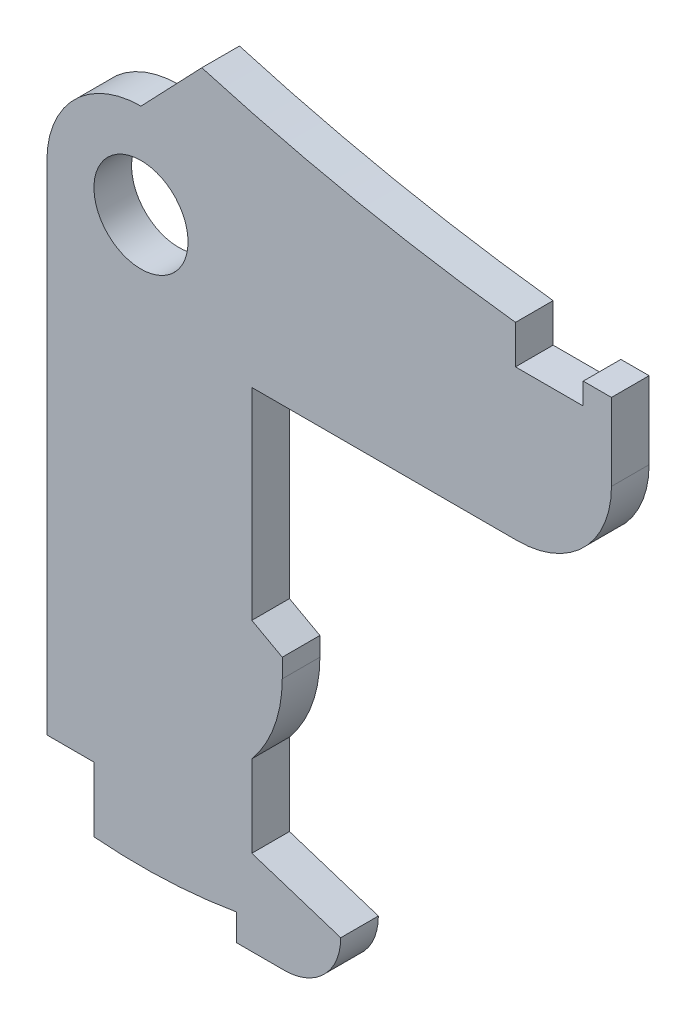
from build123d import *

# Parameters (mm, degrees)
SKETCH_1_R      = 2.5
EXTRUDE_1_DEPTH = 2


with BuildPart() as part:
    # 스케치1 → 보스-돌출1 (new body)
    with BuildSketch(Plane.XY):
        with BuildLine():
            Line((58.562856649, -69.110949309), (61.100431709, -69.110949309))
            ThreePointArc((61.100431709, -69.110949309), (63.221752053, -68.232269653), (64.100431709, -66.110949309))
            Line((64.100431709, -66.110949309), (59.376120264, -64.586771365))
            Line((59.376120264, -64.586771365), (59.376120264, -60.240028533))
            ThreePointArc((59.376120264, -60.240028533), (60.576391584, -58.13775418), (60.992924776, -55.753072063))
            Line((60.992924776, -55.753072063), (60.992924776, -54.755314285))
            Line((60.992924776, -54.755314285), (59.376120264, -53.867981647))
            Line((59.376120264, -53.867981647), (59.376120264, -43.149191929))
            Line((59.376120264, -43.149191929), (73.486715323, -43.149191929))
            ThreePointArc((73.486715323, -43.149191929), (77.022249229, -41.684725835), (78.486715323, -38.149191929))
            Line((78.486715323, -38.149191929), (78.486715323, -34.05327534))
            Line((78.486715323, -34.05327534), (76.986715323, -34.05327534))
            Line((76.986715323, -34.05327534), (76.986715323, -35.198463464))
            Line((76.986715323, -35.198463464), (73.386715323, -35.198463464))
            Line((73.386715323, -35.198463464), (73.386715323, -33.149191929))
            ThreePointArc((73.386715323, -33.149191929), (64.982885636, -31.8013595), (56.718627509, -29.765912799))
            Line((56.718627509, -29.765912799), (53.486715323, -33.149191929))
            ThreePointArc((53.486715323, -33.149191929), (49.951181417, -34.613658023), (48.486715323, -38.149191929))
            Line((48.486715323, -38.149191929), (48.486715323, -64.586869755))
            Line((48.486715323, -64.586869755), (50.986715323, -64.586869755))
            Line((50.986715323, -64.586869755), (50.986715323, -68.023666262))
            ThreePointArc((50.986715323, -68.023666262), (54.785213458, -68.09995351), (58.562856649, -67.695206989))
            Line((58.562856649, -67.695206989), (58.562856649, -69.110949309))
        make_face()
        with Locations((53.486715323, -38.149191929)):
            Circle(SKETCH_1_R, mode=Mode.SUBTRACT)
    extrude(amount=EXTRUDE_1_DEPTH)


solid = part.part
